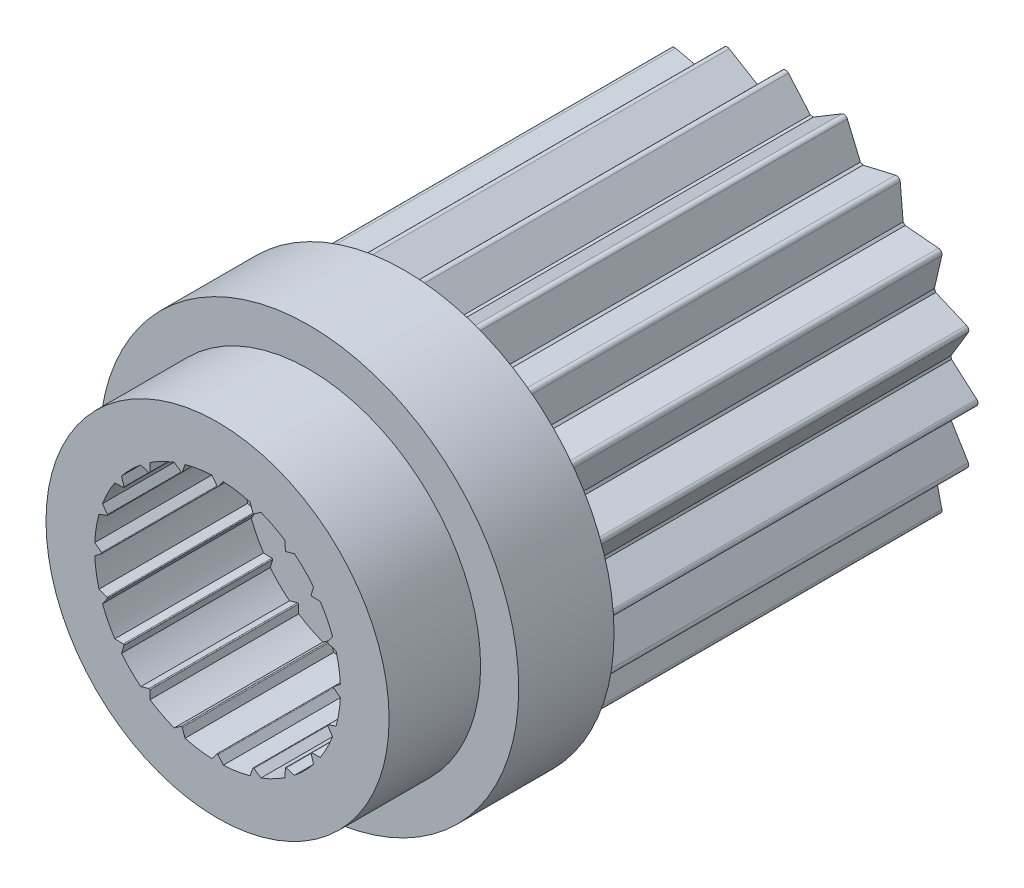
from build123d import *

# Parameters (mm, degrees)
BOSS_EXTRUDE3_REACH = 18.808
BOSS_EXTRUDE4_DEPTH = 3.9
CUT_EXTRUDE1_DEPTH  = 2.2


with BuildPart() as part:
    # Sketch3 → Revolve1 (revolve)
    with BuildSketch(Plane(origin=(0, 0, 0), x_dir=(0, 0, -1), z_dir=(1, 0, 0)), mode=Mode.PRIVATE) as revolve1_sk:
        Polygon((-3.9, 3.225), (-3.9, 4.5), (-1.5, 4.5), (-1.5, 5.5), (1, 5.5), (1, 4.4), (11, 4.4), (11, 1.75), (1.5, 1.75), (0, 1.75), (0, 3.225), align=None)
    revolve(revolve1_sk.sketch.rotate(Axis((0, 0, 3.843956044), (0, 0, -1)), 90), axis=Axis((0, 0, 3.843956044), (0, 0, -1)))

    # Sketch5 → Boss-Extrude3 (add, up to next)
    with BuildSketch(Plane(origin=(0, 0, -11), x_dir=(-1, 0, 0), z_dir=(0, 0, -1)), mode=Mode.PRIVATE) as boss_extrude3_sk1:
        with BuildLine():
            Line((-0.65, 4.351723796), (-0.075494261, 5.013091448))
            ThreePointArc((-0.075494261, 5.013091448), (0, 5.047512361), (0.075494261, 5.013091448))
            Line((0.075494261, 5.013091448), (0.65, 4.351723796))
            ThreePointArc((0.65, 4.351723796), (0, 4.4), (-0.65, 4.351723796))
        make_face()
    boss_extrude3_tool1 = extrude(boss_extrude3_sk1.sketch, amount=-BOSS_EXTRUDE3_REACH, mode=Mode.PRIVATE) - part.part
    # Sketch5 → Boss-Extrude3 (add, up to next)
    with BuildSketch(Plane(origin=(0, 0, -11), x_dir=(-1, 0, 0), z_dir=(0, 0, -1)), mode=Mode.PRIVATE) as boss_extrude3_sk2:
        with BuildLine():
            Line((0.726569872, 4.33959632), (1.477331143, 4.791062298))
            ThreePointArc((1.477331143, 4.791062298), (1.559767099, 4.800469522), (1.620929761, 4.744404278))
            Line((1.620929761, 4.744404278), (1.962943343, 3.937874227))
            ThreePointArc((1.962943343, 3.937874227), (1.359674775, 4.184648672), (0.726569872, 4.33959632))
        make_face()
    boss_extrude3_tool2 = extrude(boss_extrude3_sk2.sketch, amount=-BOSS_EXTRUDE3_REACH, mode=Mode.PRIVATE) - part.part
    # Sketch5 → Boss-Extrude3 (add, up to next)
    with BuildSketch(Plane(origin=(0, 0, -11), x_dir=(-1, 0, 0), z_dir=(0, 0, -1)), mode=Mode.PRIVATE) as boss_extrude3_sk3:
        with BuildLine():
            Line((2.032018023, 3.90267892), (2.885545081, 4.100050589))
            ThreePointArc((2.885545081, 4.100050589), (2.966853327, 4.08352328), (3.007697361, 4.011301762))
            Line((3.007697361, 4.011301762), (3.083740116, 3.138558092))
            ThreePointArc((3.083740116, 3.138558092), (2.58625511, 3.559674775), (2.032018023, 3.90267892))
        make_face()
    boss_extrude3_tool3 = extrude(boss_extrude3_sk3.sketch, amount=-BOSS_EXTRUDE3_REACH, mode=Mode.PRIVATE) - part.part
    # Sketch5 → Boss-Extrude3 (add, up to next)
    with BuildSketch(Plane(origin=(0, 0, -11), x_dir=(-1, 0, 0), z_dir=(0, 0, -1)), mode=Mode.PRIVATE) as boss_extrude3_sk4:
        with BuildLine():
            Line((3.138558092, 3.083740116), (4.011301762, 3.007697361))
            ThreePointArc((4.011301762, 3.007697361), (4.08352328, 2.966853327), (4.100050589, 2.885545081))
            Line((4.100050589, 2.885545081), (3.90267892, 2.032018023))
            ThreePointArc((3.90267892, 2.032018023), (3.559674775, 2.58625511), (3.138558092, 3.083740116))
        make_face()
    boss_extrude3_tool4 = extrude(boss_extrude3_sk4.sketch, amount=-BOSS_EXTRUDE3_REACH, mode=Mode.PRIVATE) - part.part
    # Sketch5 → Boss-Extrude3 (add, up to next)
    with BuildSketch(Plane(origin=(0, 0, -11), x_dir=(-1, 0, 0), z_dir=(0, 0, -1)), mode=Mode.PRIVATE) as boss_extrude3_sk5:
        with BuildLine():
            Line((3.937874227, 1.962943343), (4.744404278, 1.620929761))
            ThreePointArc((4.744404278, 1.620929761), (4.800469522, 1.559767099), (4.791062298, 1.477331143))
            Line((4.791062298, 1.477331143), (4.33959632, 0.726569872))
            ThreePointArc((4.33959632, 0.726569872), (4.184648672, 1.359674775), (3.937874227, 1.962943343))
        make_face()
    boss_extrude3_tool5 = extrude(boss_extrude3_sk5.sketch, amount=-BOSS_EXTRUDE3_REACH, mode=Mode.PRIVATE) - part.part
    # Sketch5 → Boss-Extrude3 (add, up to next)
    with BuildSketch(Plane(origin=(0, 0, -11), x_dir=(-1, 0, 0), z_dir=(0, 0, -1)), mode=Mode.PRIVATE) as boss_extrude3_sk6:
        with BuildLine():
            Line((4.351723796, 0.65), (5.013091448, 0.075494261))
            ThreePointArc((5.013091448, 0.075494261), (5.047512361, 0), (5.013091448, -0.075494261))
            Line((5.013091448, -0.075494261), (4.351723796, -0.65))
            ThreePointArc((4.351723796, -0.65), (4.4, 0), (4.351723796, 0.65))
        make_face()
    boss_extrude3_tool6 = extrude(boss_extrude3_sk6.sketch, amount=-BOSS_EXTRUDE3_REACH, mode=Mode.PRIVATE) - part.part
    # Sketch5 → Boss-Extrude3 (add, up to next)
    with BuildSketch(Plane(origin=(0, 0, -11), x_dir=(-1, 0, 0), z_dir=(0, 0, -1)), mode=Mode.PRIVATE) as boss_extrude3_sk7:
        with BuildLine():
            Line((4.33959632, -0.726569872), (4.791062298, -1.477331143))
            ThreePointArc((4.791062298, -1.477331143), (4.800469522, -1.559767099), (4.744404278, -1.620929761))
            Line((4.744404278, -1.620929761), (3.937874227, -1.962943343))
            ThreePointArc((3.937874227, -1.962943343), (4.184648672, -1.359674775), (4.33959632, -0.726569872))
        make_face()
    boss_extrude3_tool7 = extrude(boss_extrude3_sk7.sketch, amount=-BOSS_EXTRUDE3_REACH, mode=Mode.PRIVATE) - part.part
    # Sketch5 → Boss-Extrude3 (add, up to next)
    with BuildSketch(Plane(origin=(0, 0, -11), x_dir=(-1, 0, 0), z_dir=(0, 0, -1)), mode=Mode.PRIVATE) as boss_extrude3_sk8:
        with BuildLine():
            Line((3.90267892, -2.032018023), (4.100050589, -2.885545081))
            ThreePointArc((4.100050589, -2.885545081), (4.08352328, -2.966853327), (4.011301762, -3.007697361))
            Line((4.011301762, -3.007697361), (3.138558092, -3.083740116))
            ThreePointArc((3.138558092, -3.083740116), (3.559674775, -2.58625511), (3.90267892, -2.032018023))
        make_face()
    boss_extrude3_tool8 = extrude(boss_extrude3_sk8.sketch, amount=-BOSS_EXTRUDE3_REACH, mode=Mode.PRIVATE) - part.part
    # Sketch5 → Boss-Extrude3 (add, up to next)
    with BuildSketch(Plane(origin=(0, 0, -11), x_dir=(-1, 0, 0), z_dir=(0, 0, -1)), mode=Mode.PRIVATE) as boss_extrude3_sk9:
        with BuildLine():
            Line((3.083740116, -3.138558092), (3.007697361, -4.011301762))
            ThreePointArc((3.007697361, -4.011301762), (2.966853327, -4.08352328), (2.885545081, -4.100050589))
            Line((2.885545081, -4.100050589), (2.032018023, -3.90267892))
            ThreePointArc((2.032018023, -3.90267892), (2.58625511, -3.559674775), (3.083740116, -3.138558092))
        make_face()
    boss_extrude3_tool9 = extrude(boss_extrude3_sk9.sketch, amount=-BOSS_EXTRUDE3_REACH, mode=Mode.PRIVATE) - part.part
    # Sketch5 → Boss-Extrude3 (add, up to next)
    with BuildSketch(Plane(origin=(0, 0, -11), x_dir=(-1, 0, 0), z_dir=(0, 0, -1)), mode=Mode.PRIVATE) as boss_extrude3_sk10:
        with BuildLine():
            Line((1.962943343, -3.937874227), (1.620929761, -4.744404278))
            ThreePointArc((1.620929761, -4.744404278), (1.559767099, -4.800469522), (1.477331143, -4.791062298))
            Line((1.477331143, -4.791062298), (0.726569872, -4.33959632))
            ThreePointArc((0.726569872, -4.33959632), (1.359674775, -4.184648672), (1.962943343, -3.937874227))
        make_face()
    boss_extrude3_tool10 = extrude(boss_extrude3_sk10.sketch, amount=-BOSS_EXTRUDE3_REACH, mode=Mode.PRIVATE) - part.part
    # Sketch5 → Boss-Extrude3 (add, up to next)
    with BuildSketch(Plane(origin=(0, 0, -11), x_dir=(-1, 0, 0), z_dir=(0, 0, -1)), mode=Mode.PRIVATE) as boss_extrude3_sk11:
        with BuildLine():
            Line((0.65, -4.351723796), (0.075494261, -5.013091448))
            ThreePointArc((0.075494261, -5.013091448), (0, -5.047512361), (-0.075494261, -5.013091448))
            Line((-0.075494261, -5.013091448), (-0.65, -4.351723796))
            ThreePointArc((-0.65, -4.351723796), (0, -4.4), (0.65, -4.351723796))
        make_face()
    boss_extrude3_tool11 = extrude(boss_extrude3_sk11.sketch, amount=-BOSS_EXTRUDE3_REACH, mode=Mode.PRIVATE) - part.part
    # Sketch5 → Boss-Extrude3 (add, up to next)
    with BuildSketch(Plane(origin=(0, 0, -11), x_dir=(-1, 0, 0), z_dir=(0, 0, -1)), mode=Mode.PRIVATE) as boss_extrude3_sk12:
        with BuildLine():
            Line((-0.726569872, -4.33959632), (-1.477331143, -4.791062298))
            ThreePointArc((-1.477331143, -4.791062298), (-1.559767099, -4.800469522), (-1.620929761, -4.744404278))
            Line((-1.620929761, -4.744404278), (-1.962943343, -3.937874227))
            ThreePointArc((-1.962943343, -3.937874227), (-1.359674775, -4.184648672), (-0.726569872, -4.33959632))
        make_face()
    boss_extrude3_tool12 = extrude(boss_extrude3_sk12.sketch, amount=-BOSS_EXTRUDE3_REACH, mode=Mode.PRIVATE) - part.part
    # Sketch5 → Boss-Extrude3 (add, up to next)
    with BuildSketch(Plane(origin=(0, 0, -11), x_dir=(-1, 0, 0), z_dir=(0, 0, -1)), mode=Mode.PRIVATE) as boss_extrude3_sk13:
        with BuildLine():
            Line((-2.032018023, -3.90267892), (-2.885545081, -4.100050589))
            ThreePointArc((-2.885545081, -4.100050589), (-2.966853327, -4.08352328), (-3.007697361, -4.011301762))
            Line((-3.007697361, -4.011301762), (-3.083740116, -3.138558092))
            ThreePointArc((-3.083740116, -3.138558092), (-2.58625511, -3.559674775), (-2.032018023, -3.90267892))
        make_face()
    boss_extrude3_tool13 = extrude(boss_extrude3_sk13.sketch, amount=-BOSS_EXTRUDE3_REACH, mode=Mode.PRIVATE) - part.part
    # Sketch5 → Boss-Extrude3 (add, up to next)
    with BuildSketch(Plane(origin=(0, 0, -11), x_dir=(-1, 0, 0), z_dir=(0, 0, -1)), mode=Mode.PRIVATE) as boss_extrude3_sk14:
        with BuildLine():
            Line((-3.138558092, -3.083740116), (-4.011301762, -3.007697361))
            ThreePointArc((-4.011301762, -3.007697361), (-4.08352328, -2.966853327), (-4.100050589, -2.885545081))
            Line((-4.100050589, -2.885545081), (-3.90267892, -2.032018023))
            ThreePointArc((-3.90267892, -2.032018023), (-3.559674775, -2.58625511), (-3.138558092, -3.083740116))
        make_face()
    boss_extrude3_tool14 = extrude(boss_extrude3_sk14.sketch, amount=-BOSS_EXTRUDE3_REACH, mode=Mode.PRIVATE) - part.part
    # Sketch5 → Boss-Extrude3 (add, up to next)
    with BuildSketch(Plane(origin=(0, 0, -11), x_dir=(-1, 0, 0), z_dir=(0, 0, -1)), mode=Mode.PRIVATE) as boss_extrude3_sk15:
        with BuildLine():
            Line((-3.937874227, -1.962943343), (-4.744404278, -1.620929761))
            ThreePointArc((-4.744404278, -1.620929761), (-4.800469522, -1.559767099), (-4.791062298, -1.477331143))
            Line((-4.791062298, -1.477331143), (-4.33959632, -0.726569872))
            ThreePointArc((-4.33959632, -0.726569872), (-4.184648672, -1.359674775), (-3.937874227, -1.962943343))
        make_face()
    boss_extrude3_tool15 = extrude(boss_extrude3_sk15.sketch, amount=-BOSS_EXTRUDE3_REACH, mode=Mode.PRIVATE) - part.part
    # Sketch5 → Boss-Extrude3 (add, up to next)
    with BuildSketch(Plane(origin=(0, 0, -11), x_dir=(-1, 0, 0), z_dir=(0, 0, -1)), mode=Mode.PRIVATE) as boss_extrude3_sk16:
        with BuildLine():
            Line((-4.351723796, -0.65), (-5.013091448, -0.075494261))
            ThreePointArc((-5.013091448, -0.075494261), (-5.047512361, 0), (-5.013091448, 0.075494261))
            Line((-5.013091448, 0.075494261), (-4.351723796, 0.65))
            ThreePointArc((-4.351723796, 0.65), (-4.4, 0), (-4.351723796, -0.65))
        make_face()
    boss_extrude3_tool16 = extrude(boss_extrude3_sk16.sketch, amount=-BOSS_EXTRUDE3_REACH, mode=Mode.PRIVATE) - part.part
    # Sketch5 → Boss-Extrude3 (add, up to next)
    with BuildSketch(Plane(origin=(0, 0, -11), x_dir=(-1, 0, 0), z_dir=(0, 0, -1)), mode=Mode.PRIVATE) as boss_extrude3_sk17:
        with BuildLine():
            Line((-4.33959632, 0.726569872), (-4.791062298, 1.477331143))
            ThreePointArc((-4.791062298, 1.477331143), (-4.800469522, 1.559767099), (-4.744404278, 1.620929761))
            Line((-4.744404278, 1.620929761), (-3.937874227, 1.962943343))
            ThreePointArc((-3.937874227, 1.962943343), (-4.184648672, 1.359674775), (-4.33959632, 0.726569872))
        make_face()
    boss_extrude3_tool17 = extrude(boss_extrude3_sk17.sketch, amount=-BOSS_EXTRUDE3_REACH, mode=Mode.PRIVATE) - part.part
    # Sketch5 → Boss-Extrude3 (add, up to next)
    with BuildSketch(Plane(origin=(0, 0, -11), x_dir=(-1, 0, 0), z_dir=(0, 0, -1)), mode=Mode.PRIVATE) as boss_extrude3_sk18:
        with BuildLine():
            Line((-3.90267892, 2.032018023), (-4.100050589, 2.885545081))
            ThreePointArc((-4.100050589, 2.885545081), (-4.08352328, 2.966853327), (-4.011301762, 3.007697361))
            Line((-4.011301762, 3.007697361), (-3.138558092, 3.083740116))
            ThreePointArc((-3.138558092, 3.083740116), (-3.559674775, 2.58625511), (-3.90267892, 2.032018023))
        make_face()
    boss_extrude3_tool18 = extrude(boss_extrude3_sk18.sketch, amount=-BOSS_EXTRUDE3_REACH, mode=Mode.PRIVATE) - part.part
    # Sketch5 → Boss-Extrude3 (add, up to next)
    with BuildSketch(Plane(origin=(0, 0, -11), x_dir=(-1, 0, 0), z_dir=(0, 0, -1)), mode=Mode.PRIVATE) as boss_extrude3_sk19:
        with BuildLine():
            Line((-3.083740116, 3.138558092), (-3.007697361, 4.011301762))
            ThreePointArc((-3.007697361, 4.011301762), (-2.966853327, 4.08352328), (-2.885545081, 4.100050589))
            Line((-2.885545081, 4.100050589), (-2.032018023, 3.90267892))
            ThreePointArc((-2.032018023, 3.90267892), (-2.58625511, 3.559674775), (-3.083740116, 3.138558092))
        make_face()
    boss_extrude3_tool19 = extrude(boss_extrude3_sk19.sketch, amount=-BOSS_EXTRUDE3_REACH, mode=Mode.PRIVATE) - part.part
    # Sketch5 → Boss-Extrude3 (add, up to next)
    with BuildSketch(Plane(origin=(0, 0, -11), x_dir=(-1, 0, 0), z_dir=(0, 0, -1)), mode=Mode.PRIVATE) as boss_extrude3_sk20:
        with BuildLine():
            Line((-1.962943343, 3.937874227), (-1.620929761, 4.744404278))
            ThreePointArc((-1.620929761, 4.744404278), (-1.559767099, 4.800469522), (-1.477331143, 4.791062298))
            Line((-1.477331143, 4.791062298), (-0.726569872, 4.33959632))
            ThreePointArc((-0.726569872, 4.33959632), (-1.359674775, 4.184648672), (-1.962943343, 3.937874227))
        make_face()
    boss_extrude3_tool20 = extrude(boss_extrude3_sk20.sketch, amount=-BOSS_EXTRUDE3_REACH, mode=Mode.PRIVATE) - part.part
    add(boss_extrude3_tool1.solids().sort_by_distance((0, 4.619903, -11))[0])
    add(boss_extrude3_tool2.solids().sort_by_distance((-1.427629, 4.393789, -11))[0])
    add(boss_extrude3_tool3.solids().sort_by_distance((-2.715511, 3.73758, -11))[0])
    add(boss_extrude3_tool4.solids().sort_by_distance((-3.73758, 2.715511, -11))[0])
    add(boss_extrude3_tool5.solids().sort_by_distance((-4.393789, 1.427629, -11))[0])
    add(boss_extrude3_tool6.solids().sort_by_distance((-4.619903, 0, -11))[0])
    add(boss_extrude3_tool7.solids().sort_by_distance((-4.393789, -1.427629, -11))[0])
    add(boss_extrude3_tool8.solids().sort_by_distance((-3.73758, -2.715511, -11))[0])
    add(boss_extrude3_tool9.solids().sort_by_distance((-2.715511, -3.73758, -11))[0])
    add(boss_extrude3_tool10.solids().sort_by_distance((-1.427629, -4.393789, -11))[0])
    add(boss_extrude3_tool11.solids().sort_by_distance((0, -4.619903, -11))[0])
    add(boss_extrude3_tool12.solids().sort_by_distance((1.427629, -4.393789, -11))[0])
    add(boss_extrude3_tool13.solids().sort_by_distance((2.715511, -3.73758, -11))[0])
    add(boss_extrude3_tool14.solids().sort_by_distance((3.73758, -2.715511, -11))[0])
    add(boss_extrude3_tool15.solids().sort_by_distance((4.393789, -1.427629, -11))[0])
    add(boss_extrude3_tool16.solids().sort_by_distance((4.619903, 0, -11))[0])
    add(boss_extrude3_tool17.solids().sort_by_distance((4.393789, 1.427629, -11))[0])
    add(boss_extrude3_tool18.solids().sort_by_distance((3.73758, 2.715511, -11))[0])
    add(boss_extrude3_tool19.solids().sort_by_distance((2.715511, 3.73758, -11))[0])
    add(boss_extrude3_tool20.solids().sort_by_distance((1.427629, 4.393789, -11))[0])

    # Sketch6 → Boss-Extrude4 (add)
    with BuildSketch(Plane.XY.offset(3.9)):
        with BuildLine():
            Line((-0.15, 3.221509739), (-0.015897775, 3.045827117))
            ThreePointArc((-0.015897775, 3.045827117), (0, 3.037962222), (0.015897775, 3.045827117))
            Line((0.015897775, 3.045827117), (0.15, 3.221509739))
            ThreePointArc((0.15, 3.221509739), (0, 3.225), (-0.15, 3.221509739))
        make_face()
        with BuildLine():
            Line((0.956332023, 2.891841045), (1.138159734, 3.017485281))
            ThreePointArc((1.138159734, 3.017485281), (0.996579807, 3.067157265), (0.85284278, 3.110190379))
            Line((0.85284278, 3.110190379), (0.926092659, 2.90166641))
            ThreePointArc((0.926092659, 2.90166641), (0.938781955, 2.889273767), (0.956332023, 2.891841045))
        make_face()
        with BuildLine():
            Line((1.80315383, 2.454781422), (2.014908464, 2.518088339))
            ThreePointArc((2.014908464, 2.518088339), (1.895607439, 2.609079807), (1.772203366, 2.694423914))
            Line((1.772203366, 2.694423914), (1.777430691, 2.473470377))
            ThreePointArc((1.777430691, 2.473470377), (1.785669391, 2.457763065), (1.80315383, 2.454781422))
        make_face()
        with BuildLine():
            Line((2.473470377, 1.777430691), (2.694423914, 1.772203366))
            ThreePointArc((2.694423914, 1.772203366), (2.609079807, 1.895607439), (2.518088339, 2.014908464))
            Line((2.518088339, 2.014908464), (2.454781422, 1.80315383))
            ThreePointArc((2.454781422, 1.80315383), (2.457763065, 1.785669391), (2.473470377, 1.777430691))
        make_face()
        with BuildLine():
            Line((2.90166641, 0.926092659), (3.110190379, 0.85284278))
            ThreePointArc((3.110190379, 0.85284278), (3.067157265, 0.996579807), (3.017485281, 1.138159734))
            Line((3.017485281, 1.138159734), (2.891841045, 0.956332023))
            ThreePointArc((2.891841045, 0.956332023), (2.889273767, 0.938781955), (2.90166641, 0.926092659))
        make_face()
        with BuildLine():
            Line((3.045827117, -0.015897775), (3.221509739, -0.15))
            ThreePointArc((3.221509739, -0.15), (3.225, 0), (3.221509739, 0.15))
            Line((3.221509739, 0.15), (3.045827117, 0.015897775))
            ThreePointArc((3.045827117, 0.015897775), (3.037962222, 0), (3.045827117, -0.015897775))
        make_face()
        with BuildLine():
            Line((2.891841045, -0.956332023), (3.017485281, -1.138159734))
            ThreePointArc((3.017485281, -1.138159734), (3.067157265, -0.996579807), (3.110190379, -0.85284278))
            Line((3.110190379, -0.85284278), (2.90166641, -0.926092659))
            ThreePointArc((2.90166641, -0.926092659), (2.889273767, -0.938781955), (2.891841045, -0.956332023))
        make_face()
        with BuildLine():
            Line((2.454781422, -1.80315383), (2.518088339, -2.014908464))
            ThreePointArc((2.518088339, -2.014908464), (2.609079807, -1.895607439), (2.694423914, -1.772203366))
            Line((2.694423914, -1.772203366), (2.473470377, -1.777430691))
            ThreePointArc((2.473470377, -1.777430691), (2.457763065, -1.785669391), (2.454781422, -1.80315383))
        make_face()
        with BuildLine():
            Line((1.777430691, -2.473470377), (1.772203366, -2.694423914))
            ThreePointArc((1.772203366, -2.694423914), (1.895607439, -2.609079807), (2.014908464, -2.518088339))
            Line((2.014908464, -2.518088339), (1.80315383, -2.454781422))
            ThreePointArc((1.80315383, -2.454781422), (1.785669391, -2.457763065), (1.777430691, -2.473470377))
        make_face()
        with BuildLine():
            Line((0.926092659, -2.90166641), (0.85284278, -3.110190379))
            ThreePointArc((0.85284278, -3.110190379), (0.996579807, -3.067157265), (1.138159734, -3.017485281))
            Line((1.138159734, -3.017485281), (0.956332023, -2.891841045))
            ThreePointArc((0.956332023, -2.891841045), (0.938781955, -2.889273767), (0.926092659, -2.90166641))
        make_face()
        with BuildLine():
            Line((-0.015897775, -3.045827117), (-0.15, -3.221509739))
            ThreePointArc((-0.15, -3.221509739), (0, -3.225), (0.15, -3.221509739))
            Line((0.15, -3.221509739), (0.015897775, -3.045827117))
            ThreePointArc((0.015897775, -3.045827117), (0, -3.037962222), (-0.015897775, -3.045827117))
        make_face()
        with BuildLine():
            Line((-0.956332023, -2.891841045), (-1.138159734, -3.017485281))
            ThreePointArc((-1.138159734, -3.017485281), (-0.996579807, -3.067157265), (-0.85284278, -3.110190379))
            Line((-0.85284278, -3.110190379), (-0.926092659, -2.90166641))
            ThreePointArc((-0.926092659, -2.90166641), (-0.938781955, -2.889273767), (-0.956332023, -2.891841045))
        make_face()
        with BuildLine():
            Line((-1.80315383, -2.454781422), (-2.014908464, -2.518088339))
            ThreePointArc((-2.014908464, -2.518088339), (-1.895607439, -2.609079807), (-1.772203366, -2.694423914))
            Line((-1.772203366, -2.694423914), (-1.777430691, -2.473470377))
            ThreePointArc((-1.777430691, -2.473470377), (-1.785669391, -2.457763065), (-1.80315383, -2.454781422))
        make_face()
        with BuildLine():
            Line((-2.473470377, -1.777430691), (-2.694423914, -1.772203366))
            ThreePointArc((-2.694423914, -1.772203366), (-2.609079807, -1.895607439), (-2.518088339, -2.014908464))
            Line((-2.518088339, -2.014908464), (-2.454781422, -1.80315383))
            ThreePointArc((-2.454781422, -1.80315383), (-2.457763065, -1.785669391), (-2.473470377, -1.777430691))
        make_face()
        with BuildLine():
            Line((-2.90166641, -0.926092659), (-3.110190379, -0.85284278))
            ThreePointArc((-3.110190379, -0.85284278), (-3.067157265, -0.996579807), (-3.017485281, -1.138159734))
            Line((-3.017485281, -1.138159734), (-2.891841045, -0.956332023))
            ThreePointArc((-2.891841045, -0.956332023), (-2.889273767, -0.938781955), (-2.90166641, -0.926092659))
        make_face()
        with BuildLine():
            Line((-3.045827117, 0.015897775), (-3.221509739, 0.15))
            ThreePointArc((-3.221509739, 0.15), (-3.225, 0), (-3.221509739, -0.15))
            Line((-3.221509739, -0.15), (-3.045827117, -0.015897775))
            ThreePointArc((-3.045827117, -0.015897775), (-3.037962222, 0), (-3.045827117, 0.015897775))
        make_face()
        with BuildLine():
            Line((-2.891841045, 0.956332023), (-3.017485281, 1.138159734))
            ThreePointArc((-3.017485281, 1.138159734), (-3.067157265, 0.996579807), (-3.110190379, 0.85284278))
            Line((-3.110190379, 0.85284278), (-2.90166641, 0.926092659))
            ThreePointArc((-2.90166641, 0.926092659), (-2.889273767, 0.938781955), (-2.891841045, 0.956332023))
        make_face()
        with BuildLine():
            Line((-2.454781422, 1.80315383), (-2.518088339, 2.014908464))
            ThreePointArc((-2.518088339, 2.014908464), (-2.609079807, 1.895607439), (-2.694423914, 1.772203366))
            Line((-2.694423914, 1.772203366), (-2.473470377, 1.777430691))
            ThreePointArc((-2.473470377, 1.777430691), (-2.457763065, 1.785669391), (-2.454781422, 1.80315383))
        make_face()
        with BuildLine():
            Line((-1.777430691, 2.473470377), (-1.772203366, 2.694423914))
            ThreePointArc((-1.772203366, 2.694423914), (-1.895607439, 2.609079807), (-2.014908464, 2.518088339))
            Line((-2.014908464, 2.518088339), (-1.80315383, 2.454781422))
            ThreePointArc((-1.80315383, 2.454781422), (-1.785669391, 2.457763065), (-1.777430691, 2.473470377))
        make_face()
        with BuildLine():
            Line((-0.926092659, 2.90166641), (-0.85284278, 3.110190379))
            ThreePointArc((-0.85284278, 3.110190379), (-0.996579807, 3.067157265), (-1.138159734, 3.017485281))
            Line((-1.138159734, 3.017485281), (-0.956332023, 2.891841045))
            ThreePointArc((-0.956332023, 2.891841045), (-0.938781955, 2.889273767), (-0.926092659, 2.90166641))
        make_face()
    extrude(amount=-BOSS_EXTRUDE4_DEPTH)

    # Sketch7 → Cut-Extrude1 (cut)
    with BuildSketch(Plane.XY):
        with BuildLine():
            Line((-1, 3.066043868), (-1, 0))
            Line((-1, 0), (1, 0))
            Line((1, 0), (1, 3.066043868))
            ThreePointArc((1, 3.066043868), (0, 3.225), (-1, 3.066043868))
        make_face()
    extrude(amount=-CUT_EXTRUDE1_DEPTH, mode=Mode.SUBTRACT)


solid = part.part
